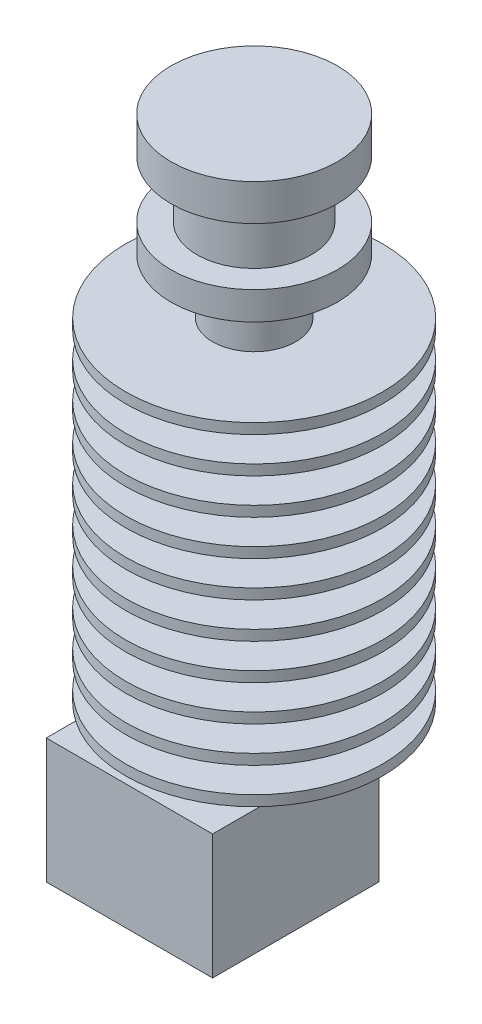
from build123d import *

# Parameters (mm, degrees)
ESBO_O3_W                = 16
ESBO_O3_H                = 16
RESSALTO_EXTRUS_O1_DEPTH = 12
ESBO_O4_R                = 3
RESSALTO_EXTRUS_O2_DEPTH = 5
RESSALTO_EXTRUS_O2_TAPER = 26


with BuildPart() as part:
    # Esboço1 → Revolução1 (revolve)
    with BuildSketch(Plane.XY, mode=Mode.PRIVATE) as revolu_o1_sk:
        Polygon((0, 51.659238703), (0, 1.659238703), (2, 1.659238703), (2, 2.659238703), (12.35, 2.659238703), (12.35, 3.659238703), (4, 3.659238703), (4, 6.103683147), (12.35, 6.103683147), (12.35, 7.103683147), (4, 7.103683147), (4, 9.548127592), (12.35, 9.548127592), (12.35, 10.548127592), (4, 10.548127592), (4, 12.992572036), (12.35, 12.992572036), (12.35, 13.992572036), (4, 13.992572036), (4, 16.437016481), (12.35, 16.437016481), (12.35, 17.437016481), (4, 17.437016481), (4, 19.881460925), (12.35, 19.881460925), (12.35, 20.881460925), (4, 20.881460925), (4, 23.32590537), (12.35, 23.32590537), (12.35, 24.32590537), (4, 24.32590537), (4, 26.770349814), (12.35, 26.770349814), (12.35, 27.770349814), (4, 27.770349814), (4, 30.214794259), (12.35, 30.214794259), (12.35, 31.214794259), (4, 31.214794259), (4, 33.659238703), (12.35, 33.659238703), (12.35, 34.659238703), (4, 34.659238703), (4, 39.959238703), (8, 39.959238703), (8, 42.659238703), (5.5, 42.659238703), (5.5, 48.159238703), (8, 48.159238703), (8, 51.659238703), align=None)
    revolve(revolu_o1_sk.sketch.rotate(Axis((0, 51.659238703, 0), (0, -1, 0)), 180), axis=Axis((0, 51.659238703, 0), (0, -1, 0)))

    # Esboço3 → Ressalto-extrusão1 (add)
    with BuildSketch(Plane.XZ.offset(-1.659238703)):
        with Locations((0, 4)):
            Rectangle(ESBO_O3_W, ESBO_O3_H)
    extrude(amount=RESSALTO_EXTRUS_O1_DEPTH)

    # Esboço4 → Ressalto-extrusão2 (add)
    with BuildSketch(Plane.XZ.offset(10.340761297)):
        Circle(ESBO_O4_R)
    extrude(amount=RESSALTO_EXTRUS_O2_DEPTH, taper=RESSALTO_EXTRUS_O2_TAPER)


solid = part.part
